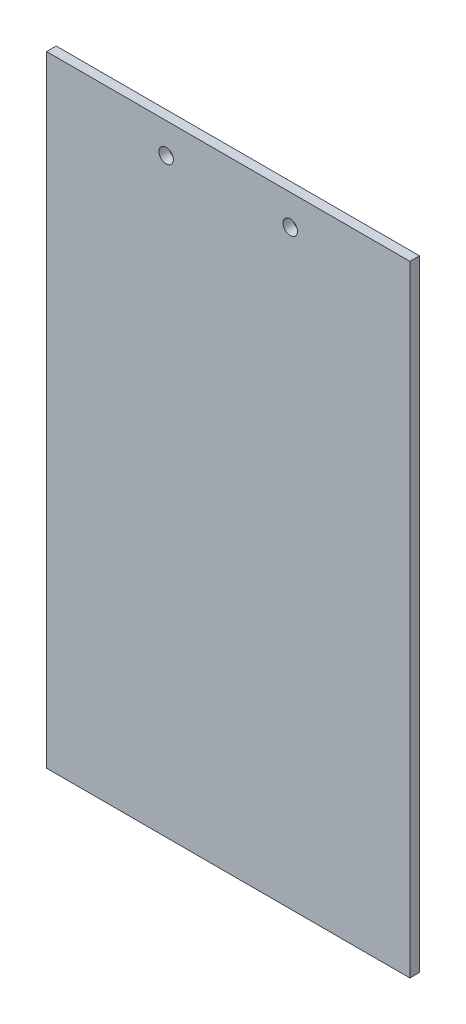
from build123d import *

# Parameters (mm, degrees)
CROQUIS1_W              = 240
CROQUIS1_H              = 410
SALIENTE_EXTRUIR1_DEPTH = 6.35
CROQUIS2_R              = 4.7625
CORTAR_EXTRUIR1_DEPTH   = 10


with BuildPart() as part:
    # Croquis1 → Saliente-Extruir1 (new body)
    with BuildSketch(Plane.XY):
        with Locations((120, -205)):
            Rectangle(CROQUIS1_W, CROQUIS1_H)
    extrude(amount=SALIENTE_EXTRUIR1_DEPTH)

    # Croquis2 → Cortar-Extruir1 (cut)
    with BuildSketch(Plane.XY.offset(6.35)):
        with Locations((161, -20)):
            Circle(CROQUIS2_R)
        with Locations((79, -20)):
            Circle(CROQUIS2_R)
    extrude(amount=-CORTAR_EXTRUIR1_DEPTH, mode=Mode.SUBTRACT)


solid = part.part
